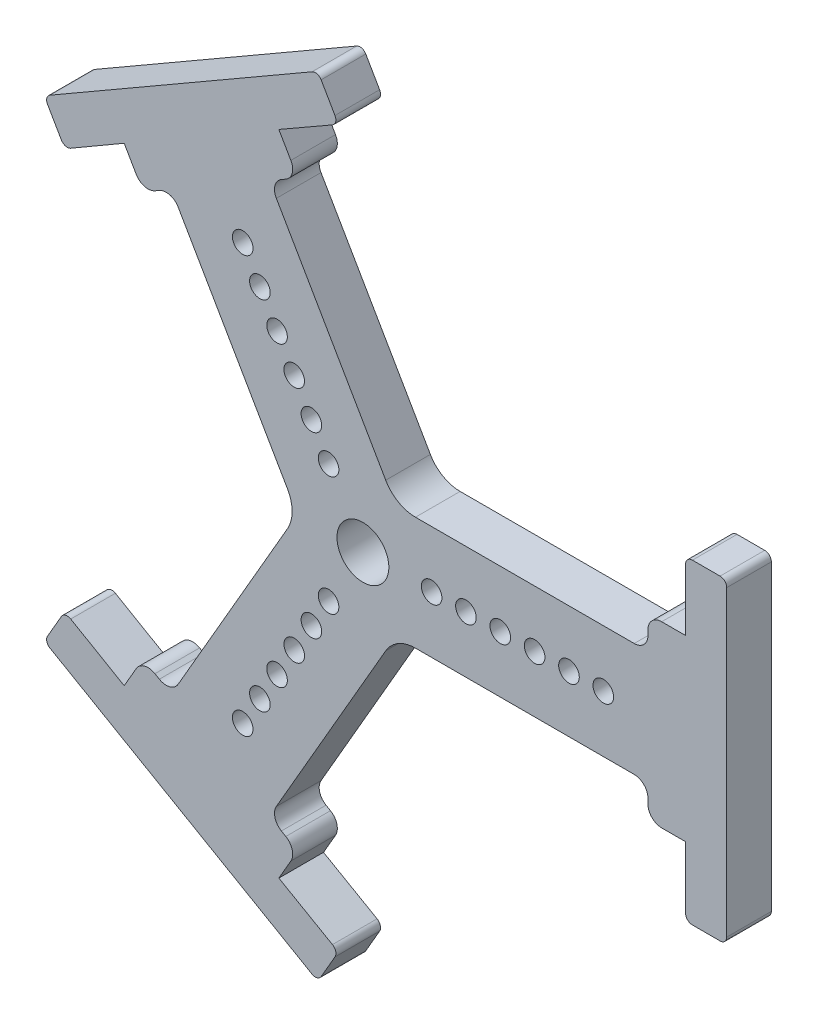
from build123d import *

# Parameters (mm, degrees)
ESQUISSE1_R        = 7.55
ESQUISSE1_R_2      = 3
BOSS_EXTRU_1_DEPTH = 13


with BuildPart() as part:
    # Esquisse1 → Boss.-Extru.1 (new body)
    with BuildSketch(Plane.XY):
        with BuildLine():
            Line((93.987648188, -26), (93.940672922, -43.994779029))
            ThreePointArc((93.940672922, -43.994779029), (94.524607857, -45.412366464), (95.940666108, -46))
            Line((95.940666108, -46), (104, -46))
            ThreePointArc((104, -46), (105.36856155, -45.433123245), (105.935438305, -44.064561695))
            Line((105.935438305, -44.064561695), (105.935438305, 44.064561695))
            ThreePointArc((105.935438305, 44.064561695), (105.36856155, 45.433123245), (104, 46))
            Line((104, 46), (95.940666108, 46))
            ThreePointArc((95.940666108, 46), (94.524607857, 45.412366464), (93.940672922, 43.994779029))
            Line((93.940672922, 43.994779029), (93.987648188, 26))
            Line((93.987648188, 26), (87, 26))
            ThreePointArc((87, 26), (84.171572875, 24.828427125), (83, 22))
            Line((83, 22), (83, 20.508086384))
            ThreePointArc((83, 20.508086384), (81.828427125, 17.679659259), (79, 16.508086384))
            Line((79, 16.508086384), (15.30445081, 16.508086384))
            ThreePointArc((15.30445081, 16.508086384), (10.30445081, 17.847832346), (6.644196772, 21.508086384))
            Line((6.644196772, 21.508086384), (-25.203577824, 76.670050091))
            ThreePointArc((-25.203577824, 76.670050091), (-25.603179514, 79.705326271), (-23.739476208, 82.134151706))
            Line((-23.739476208, 82.134151706), (-22.447441117, 82.880108514))
            ThreePointArc((-22.447441117, 82.880108514), (-20.583737812, 85.308933949), (-20.983339502, 88.344210129))
            Line((-20.983339502, 88.344210129), (-24.477163596, 94.395690973))
            Line((-24.477163596, 94.395690973), (-8.869740188, 103.352398714))
            ThreePointArc((-8.869740188, 103.352398714), (-7.934040924, 104.566894919), (-8.13316448, 106.087054105))
            Line((-8.13316448, 106.087054105), (-12.162831426, 113.066641994))
            ThreePointArc((-12.162831426, 113.066641994), (-13.338041871, 113.968412685), (-14.806689318, 113.775061581))
            Line((-14.806689318, 113.775061581), (-91.128748987, 69.710499885))
            ThreePointArc((-91.128748987, 69.710499885), (-92.030519678, 68.53528944), (-91.837168574, 67.066641994))
            Line((-91.837168574, 67.066641994), (-87.807501628, 60.087054105))
            ThreePointArc((-87.807501628, 60.087054105), (-86.590566932, 59.154528454), (-85.070932735, 59.357619685))
            Line((-85.070932735, 59.357619685), (-69.510484592, 68.395690973))
            Line((-69.510484592, 68.395690973), (-66.016660498, 62.344210129))
            ThreePointArc((-66.016660498, 62.344210129), (-63.587835064, 60.480506824), (-60.552558883, 60.880108514))
            Line((-60.552558883, 60.880108514), (-59.260523792, 61.626065322))
            ThreePointArc((-59.260523792, 61.626065322), (-56.225247611, 62.025667012), (-53.796422176, 60.161963707))
            Line((-53.796422176, 60.161963707), (-21.948647581, 5))
            ThreePointArc((-21.948647581, 5), (-20.608901619, 0), (-21.948647581, -5))
            Line((-21.948647581, -5), (-53.796422176, -60.161963707))
            ThreePointArc((-53.796422176, -60.161963707), (-56.225247611, -62.025667012), (-59.260523792, -61.626065322))
            Line((-59.260523792, -61.626065322), (-60.552558883, -60.880108514))
            ThreePointArc((-60.552558883, -60.880108514), (-63.587835064, -60.480506824), (-66.016660498, -62.344210129))
            Line((-66.016660498, -62.344210129), (-69.510484592, -68.395690973))
            Line((-69.510484592, -68.395690973), (-85.070932735, -59.357619685))
            ThreePointArc((-85.070932735, -59.357619685), (-86.590566932, -59.154528455), (-87.807501628, -60.087054105))
            Line((-87.807501628, -60.087054105), (-91.837168574, -67.066641994))
            ThreePointArc((-91.837168574, -67.066641994), (-92.030519678, -68.53528944), (-91.128748987, -69.710499885))
            Line((-91.128748987, -69.710499885), (-14.806689318, -113.775061581))
            ThreePointArc((-14.806689318, -113.775061581), (-13.338041871, -113.968412685), (-12.162831426, -113.066641994))
            Line((-12.162831426, -113.066641994), (-8.13316448, -106.087054105))
            ThreePointArc((-8.13316448, -106.087054105), (-7.934040924, -104.566894919), (-8.869740188, -103.352398714))
            Line((-8.869740188, -103.352398714), (-24.477163596, -94.395690973))
            Line((-24.477163596, -94.395690973), (-20.983339502, -88.344210129))
            ThreePointArc((-20.983339502, -88.344210129), (-20.583737812, -85.308933949), (-22.447441117, -82.880108514))
            Line((-22.447441117, -82.880108514), (-23.739476208, -82.134151706))
            ThreePointArc((-23.739476208, -82.134151706), (-25.603179514, -79.705326271), (-25.203577824, -76.670050091))
            Line((-25.203577824, -76.670050091), (6.644196772, -21.508086384))
            ThreePointArc((6.644196772, -21.508086384), (10.30445081, -17.847832346), (15.30445081, -16.508086384))
            Line((15.30445081, -16.508086384), (79, -16.508086384))
            ThreePointArc((79, -16.508086384), (81.828427125, -17.679659259), (83, -20.508086384))
            Line((83, -20.508086384), (83, -22))
            ThreePointArc((83, -22), (84.171572875, -24.828427125), (87, -26))
            Line((87, -26), (93.987648188, -26))
        make_face()
        with Locations(Location((0, 0, 0), (0, 0, 180))):
            Circle(ESQUISSE1_R, mode=Mode.SUBTRACT)
        with Locations(Location((20, 0, 0), (0, 0, 180))):
            Circle(ESQUISSE1_R_2, mode=Mode.SUBTRACT)
        with Locations(Location((40, 0, 0), (0, 0, 180))):
            Circle(ESQUISSE1_R_2, mode=Mode.SUBTRACT)
        with Locations(Location((60, 0, 0), (0, 0, 180))):
            Circle(ESQUISSE1_R_2, mode=Mode.SUBTRACT)
        with Locations(Location((70, 0, 0), (0, 0, 180))):
            Circle(ESQUISSE1_R_2, mode=Mode.SUBTRACT)
        with Locations(Location((50, 0, 0), (0, 0, 180))):
            Circle(ESQUISSE1_R_2, mode=Mode.SUBTRACT)
        with Locations(Location((30, 0, 0), (0, 0, 180))):
            Circle(ESQUISSE1_R_2, mode=Mode.SUBTRACT)
        with Locations(Location((-35, -60.621778265, 0), (0, 0, 180))):
            Circle(ESQUISSE1_R_2, mode=Mode.SUBTRACT)
        with Locations(Location((-30, -51.961524227, 0), (0, 0, 180))):
            Circle(ESQUISSE1_R_2, mode=Mode.SUBTRACT)
        with Locations(Location((-25, -43.301270189, 0), (0, 0, 180))):
            Circle(ESQUISSE1_R_2, mode=Mode.SUBTRACT)
        with Locations(Location((-15, -25.980762114, 0), (0, 0, 180))):
            Circle(ESQUISSE1_R_2, mode=Mode.SUBTRACT)
        with Locations(Location((-10, -17.320508076, 0), (0, 0, 180))):
            Circle(ESQUISSE1_R_2, mode=Mode.SUBTRACT)
        with Locations(Location((-20, -34.641016151, 0), (0, 0, 180))):
            Circle(ESQUISSE1_R_2, mode=Mode.SUBTRACT)
        with Locations(Location((-35, 60.621778265, 0), (0, 0, 180))):
            Circle(ESQUISSE1_R_2, mode=Mode.SUBTRACT)
        with Locations(Location((-30, 51.961524227, 0), (0, 0, 180))):
            Circle(ESQUISSE1_R_2, mode=Mode.SUBTRACT)
        with Locations(Location((-25, 43.301270189, 0), (0, 0, 180))):
            Circle(ESQUISSE1_R_2, mode=Mode.SUBTRACT)
        with Locations(Location((-15, 25.980762114, 0), (0, 0, 180))):
            Circle(ESQUISSE1_R_2, mode=Mode.SUBTRACT)
        with Locations(Location((-10, 17.320508076, 0), (0, 0, 180))):
            Circle(ESQUISSE1_R_2, mode=Mode.SUBTRACT)
        with Locations(Location((-20, 34.641016151, 0), (0, 0, 180))):
            Circle(ESQUISSE1_R_2, mode=Mode.SUBTRACT)
    extrude(amount=BOSS_EXTRU_1_DEPTH)


solid = part.part
